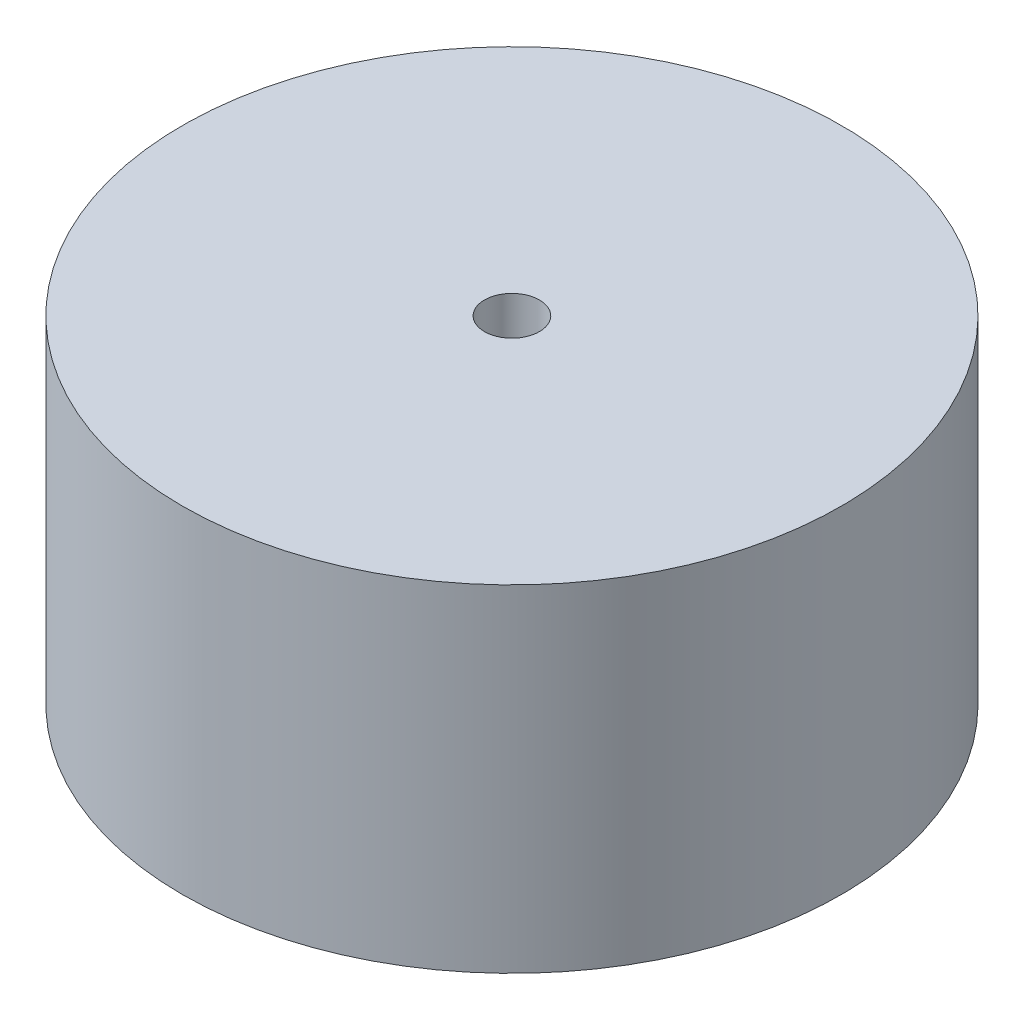
from build123d import *

# Parameters (mm, degrees)
SKETCH_1_R               = 24
EXTRUDE_2_DEPTH          = 24.5
CUT_EXTRUDE_1_DEPTH      = 42.859885332
CUT_EXTRUDE_1_DEPTH_BACK = 42.859885332
SKETCH_2_R               = 2


with BuildPart() as part:
    # 草图1 → 凸台-拉伸2 (new body)
    with BuildSketch(Plane(origin=(0, 0, 0), x_dir=(1, 0, 0), z_dir=(0, 1, 0))):
        with Locations(Location((0, 0, 0), (0, 0, 270))):
            Circle(SKETCH_1_R)
    extrude(amount=EXTRUDE_2_DEPTH)

    # 草图2 → 切除-拉伸1 (cut, two sides: drawn at the far end of the back side and taken through both)
    with BuildSketch(Plane(origin=(0, 24.5, 0), x_dir=(1, 0, 0), z_dir=(0, 1, 0)).offset(-CUT_EXTRUDE_1_DEPTH_BACK)):
        with Locations(Location((0, 0, 0), (0, 0, 270))):
            Circle(SKETCH_2_R)
    extrude(amount=CUT_EXTRUDE_1_DEPTH + CUT_EXTRUDE_1_DEPTH_BACK, mode=Mode.SUBTRACT)


solid = part.part
